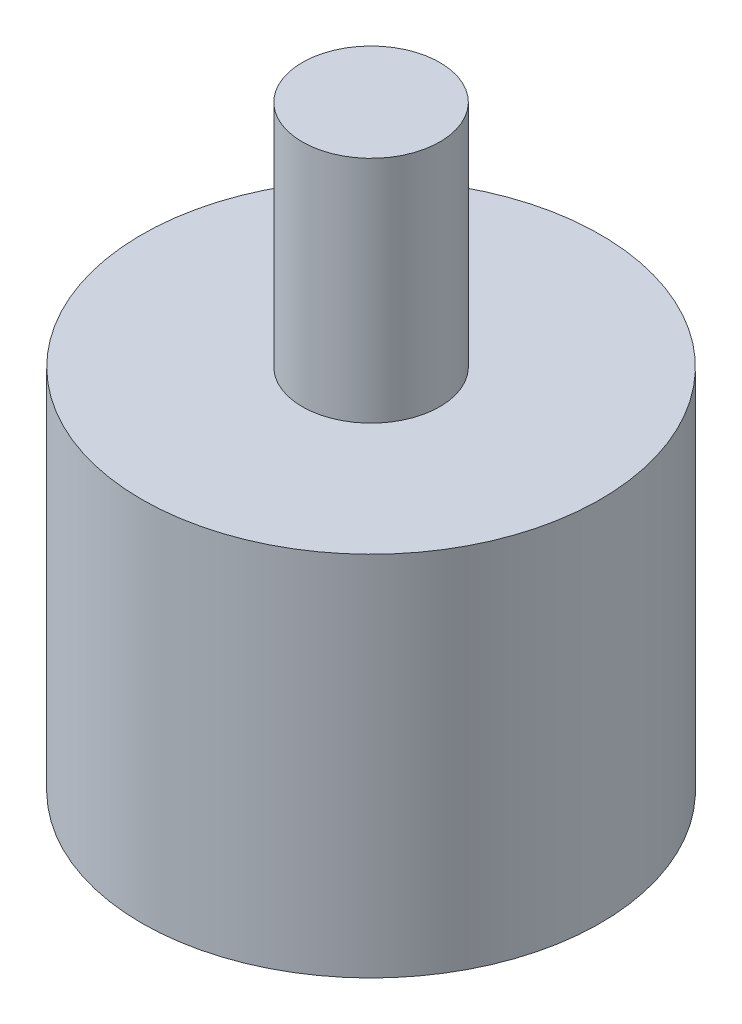
from build123d import *

# Parameters (mm, degrees)
SKETCH1_R           = 5
SKETCH1_R_2         = 2.95
BOSS_EXTRUDE1_DEPTH = 5
SKETCH2_R           = 5
BOSS_EXTRUDE2_DEPTH = 3
SKETCH3_R           = 1.5
BOSS_EXTRUDE3_DEPTH = 5


with BuildPart() as part:
    # Sketch1 → Boss-Extrude1 (new body)
    with BuildSketch(Plane(origin=(0, 0, 0), x_dir=(1, 0, 0), z_dir=(0, 1, 0))):
        with Locations(Location((0, 0, 0), (0, 0, 270))):
            Circle(SKETCH1_R)
        with Locations(Location((0, 0, 0), (0, 0, 270))):
            Circle(SKETCH1_R_2, mode=Mode.SUBTRACT)
    extrude(amount=BOSS_EXTRUDE1_DEPTH)

    # Sketch2 → Boss-Extrude2 (add)
    with BuildSketch(Plane(origin=(0, 5, 0), x_dir=(1, 0, 0), z_dir=(0, 1, 0))):
        with Locations(Location((0, 0, 0), (0, 0, 270))):
            Circle(SKETCH2_R)
    extrude(amount=BOSS_EXTRUDE2_DEPTH)

    # Sketch3 → Boss-Extrude3 (add)
    with BuildSketch(Plane(origin=(0, 8, 0), x_dir=(1, 0, 0), z_dir=(0, 1, 0))):
        with Locations(Location((0, 0, 0), (0, 0, 270))):
            Circle(SKETCH3_R)
    extrude(amount=BOSS_EXTRUDE3_DEPTH)


solid = part.part
